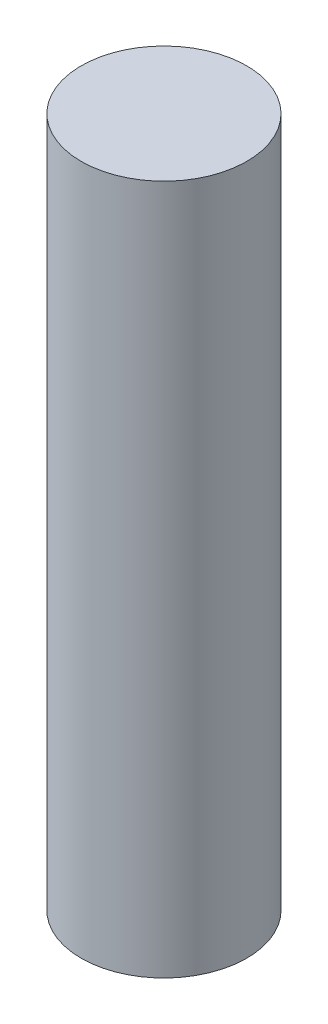
from build123d import *

# Parameters (mm, degrees)
SKETCH1_R           = 0.6
BOSS_EXTRUDE1_DEPTH = 5


with BuildPart() as part:
    # Sketch1 → Boss-Extrude1 (new body)
    with BuildSketch(Plane(origin=(0, 0, 0), x_dir=(1, 0, 0), z_dir=(0, 1, 0))):
        with Locations(Location((0, 0, 0), (0, 0, 270))):
            Circle(SKETCH1_R)
    extrude(amount=BOSS_EXTRUDE1_DEPTH)


solid = part.part
